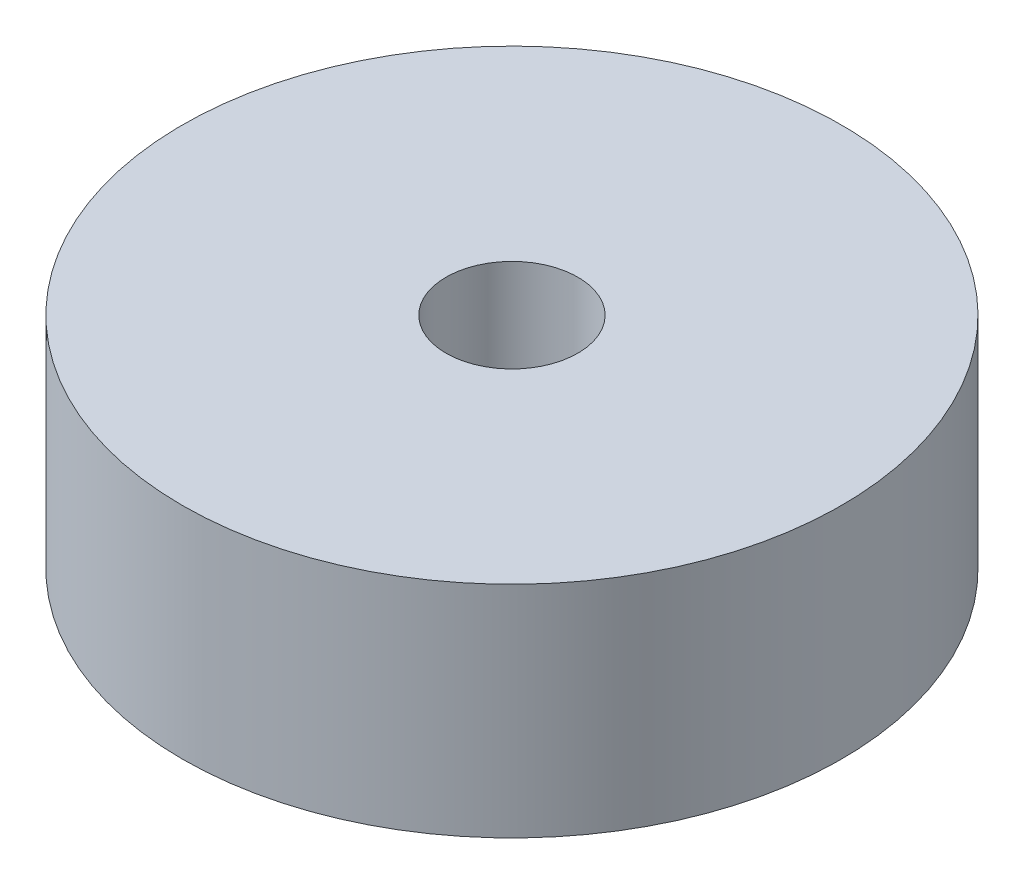
from build123d import *

# Parameters (mm, degrees)
SKETCH_1_R      = 15
SKETCH_1_R_2    = 3
EXTRUDE_1_DEPTH = 10


with BuildPart() as part:
    # 草图1 → 凸台-拉伸1 (new body)
    with BuildSketch(Plane(origin=(0, 0, 0), x_dir=(1, 0, 0), z_dir=(0, 1, 0))):
        with Locations(Location((0, 0, 0), (0, 0, 270))):
            Circle(SKETCH_1_R)
        with Locations(Location((0, 0, 0), (0, 0, 270))):
            Circle(SKETCH_1_R_2, mode=Mode.SUBTRACT)
    extrude(amount=EXTRUDE_1_DEPTH)


solid = part.part
